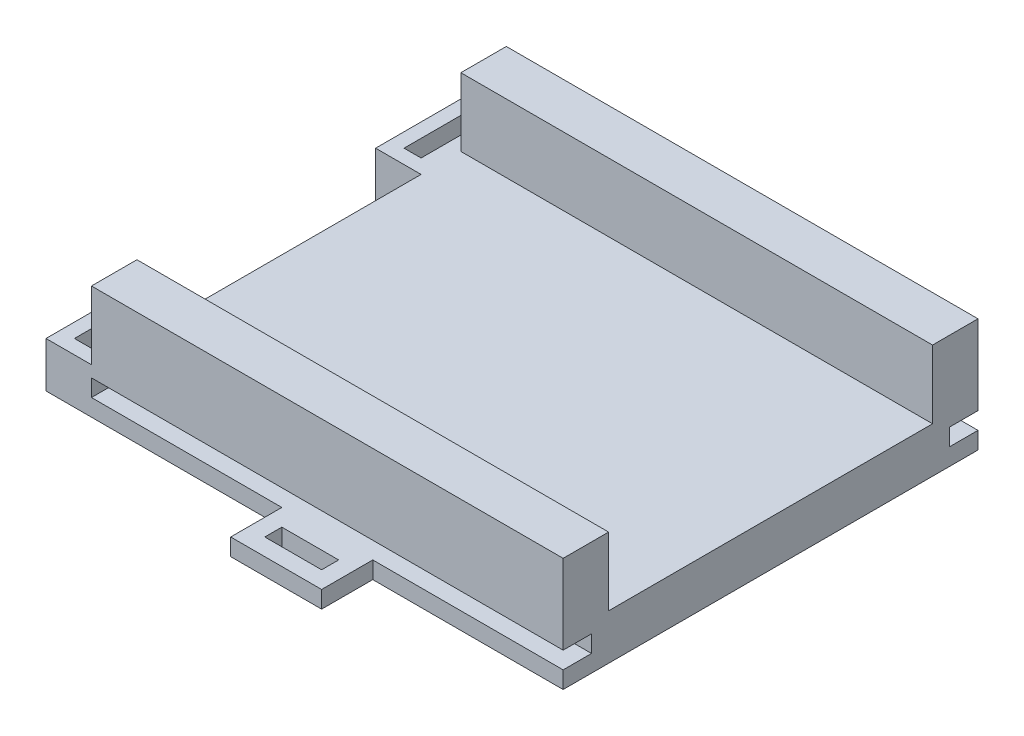
from build123d import *

# Parameters (mm, degrees)
BOSS_EXTRUDE1_DEPTH     = 41.5
SKETCH3_W               = 8
SKETCH3_H               = 15
SKETCH3_W_2             = 3
SKETCH3_H_2             = 10
BOSS_EXTRUDE2_DEPTH     = 8
SKETCH3_3_W             = 16
SKETCH3_3_H             = 9
SKETCH3_3_W_2           = 10
SKETCH3_3_H_2           = 3
BOSS_EXTRUDE3_DEPTH     = 3
CUT_EXTRUDE1_DEPTH      = 104.688234627
CUT_EXTRUDE1_DEPTH_BACK = 83
SKETCH4_W               = 5
SKETCH4_H               = 3


with BuildPart() as part:
    # Sketch2 → Boss-Extrude1 (new, symmetric)
    with BuildSketch(Plane(origin=(0, 0, 0), x_dir=(0, 0, -1), z_dir=(1, 0, 0))):
        Polygon((-28.5, 8), (28.5, 8), (28.5, 20), (36.5, 20), (36.5, 0), (-36.5, 0), (-36.5, 20), (-28.5, 20), align=None)
    extrude(amount=BOSS_EXTRUDE1_DEPTH, both=True)

    # Sketch3 → Boss-Extrude2 (add)
    # profile 1 of 2: a face of its own
    with BuildSketch(Plane(origin=(0, 0, 0), x_dir=(1, 0, 0), z_dir=(0, 1, 0))):
        with Locations((-45.5, -29)):
            Rectangle(SKETCH3_W, SKETCH3_H)
        with Locations((-45.5, -29)):
            Rectangle(SKETCH3_W_2, SKETCH3_H_2, mode=Mode.SUBTRACT)
    # profile 2 of 2: a face of its own
    with BuildSketch(Plane(origin=(0, 0, 0), x_dir=(1, 0, 0), z_dir=(0, 1, 0))):
        with Locations((-45.5, 29)):
            Rectangle(SKETCH3_W, SKETCH3_H)
        with Locations((-45.5, 29)):
            Rectangle(SKETCH3_W_2, SKETCH3_H_2, mode=Mode.SUBTRACT)
    extrude(amount=BOSS_EXTRUDE2_DEPTH)

    # Sketch3<3> → Boss-Extrude3 (add)
    # profile 1 of 2: a face of its own
    with BuildSketch(Plane(origin=(0, 0, 0), x_dir=(1, 0, 0), z_dir=(0, 1, 0))):
        with Locations((0, -41)):
            Rectangle(SKETCH3_3_W, SKETCH3_3_H)
        with Locations((0, -41)):
            Rectangle(SKETCH3_3_W_2, SKETCH3_3_H_2, mode=Mode.SUBTRACT)
    # profile 2 of 2: a face of its own
    with BuildSketch(Plane(origin=(0, 0, 0), x_dir=(1, 0, 0), z_dir=(0, 1, 0))):
        with Locations((0, 41)):
            Rectangle(SKETCH3_3_W, SKETCH3_3_H)
        with Locations((0, 41)):
            Rectangle(SKETCH3_3_W_2, SKETCH3_3_H_2, mode=Mode.SUBTRACT)
    extrude(amount=BOSS_EXTRUDE3_DEPTH)

    # Sketch4 → Cut-Extrude1 (cut, two sides: drawn at the far end of the back side and taken through both)
    with BuildSketch(Plane(origin=(41.5, 0, 0), x_dir=(0, 0, -1), z_dir=(1, 0, 0)).offset(-CUT_EXTRUDE1_DEPTH_BACK)):
        with Locations((-34, 4.5)):
            Rectangle(SKETCH4_W, SKETCH4_H)
        with Locations((34, 4.5)):
            Rectangle(SKETCH4_W, SKETCH4_H)
    extrude(amount=CUT_EXTRUDE1_DEPTH + CUT_EXTRUDE1_DEPTH_BACK, mode=Mode.SUBTRACT)


solid = part.part
